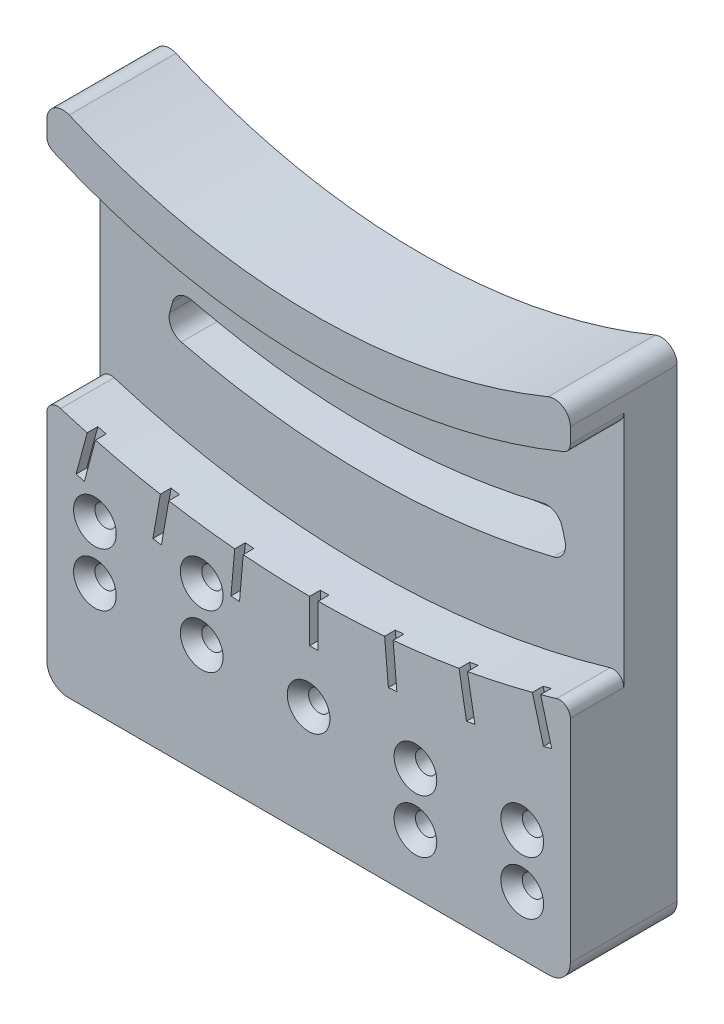
from build123d import *

# Parameters (mm, degrees)
SKETCH1_W           = 49
SKETCH1_H           = 21
SKETCH1_R           = 1
BOSS_EXTRUDE4_DEPTH = 10
CHAMFER2_SIZE       = 1
FILLET2_R           = 2
SKETCH2_W           = 49
SKETCH2_H           = 10
BOSS_EXTRUDE5_DEPTH = 30
CUT_EXTRUDE1_DEPTH  = 73
CUT_EXTRUDE2_DEPTH  = 5
SKETCH4_4_W         = 0.8
SKETCH4_4_H         = 8
CUT_EXTRUDE3_DEPTH  = 1
FILLET4_R           = 1.5
FILLET6_R           = 1.5
FILLET7_R           = 1


with BuildPart() as part:
    # Sketch1 → Boss-Extrude4 (new body)
    with BuildSketch(Plane.XY):
        with Locations((3.999954481, 0.020373254)):
            Rectangle(SKETCH1_W, SKETCH1_H)
        with Locations((-16.000045519, 0.020373254)):
            Circle(SKETCH1_R, mode=Mode.SUBTRACT)
        with Locations((-6.000045519, 0.020373254)):
            Circle(SKETCH1_R, mode=Mode.SUBTRACT)
        with Locations((13.999954481, -4.979626746)):
            Circle(SKETCH1_R, mode=Mode.SUBTRACT)
        with Locations((23.999954481, -4.979626746)):
            Circle(SKETCH1_R, mode=Mode.SUBTRACT)
        with Locations((-16.000045519, 5.020373254)):
            Circle(SKETCH1_R, mode=Mode.SUBTRACT)
        with Locations((3.999954481, 0.020373254)):
            Circle(SKETCH1_R, mode=Mode.SUBTRACT)
        with Locations((-6.000045519, 5.020373254)):
            Circle(SKETCH1_R, mode=Mode.SUBTRACT)
        with Locations((13.999954481, 0.020373254)):
            Circle(SKETCH1_R, mode=Mode.SUBTRACT)
        with Locations((23.999954481, 0.020373254)):
            Circle(SKETCH1_R, mode=Mode.SUBTRACT)
    extrude(amount=BOSS_EXTRUDE4_DEPTH)

    # Chamfer2
    chamfer2_edges = [part.edges().sort_by_distance(p)[0] for p in [
        (-17.000045519, 0.020373254, 10),
        (-17.000045519, 5.020373254, 10),
        (-7.000045519, 5.020373254, 10),
        (-7.000045519, 0.020373254, 10),
        (2.999954481, 0.020373254, 10),
        (22.999954481, 0.020373254, 10),
        (12.999954481, 0.020373254, 10),
        (12.999954481, -4.979626746, 10),
        (22.999954481, -4.979626746, 10),
    ]]
    chamfer(chamfer2_edges, length=CHAMFER2_SIZE)

    # Fillet2
    fillet2_edges = [part.edges().sort_by_distance(p)[0] for p in [
        (-20.500045519, -10.479626746, 5),
        (28.499954481, -10.479626746, 5),
    ]]
    fillet(fillet2_edges, radius=FILLET2_R)

    # Sketch2 → Boss-Extrude5 (add)
    with BuildSketch(Plane(origin=(0, 10.520373254, 0), x_dir=(1, 0, 0), z_dir=(0, 1, 0))):
        with Locations((3.999954481, -5)):
            Rectangle(SKETCH2_W, SKETCH2_H)
    extrude(amount=BOSS_EXTRUDE5_DEPTH)

    # Sketch4 → Cut-Extrude1 (cut)
    with BuildSketch(Plane.XY.offset(10)):
        with BuildLine():
            ThreePointArc((22.358468593, 22.87149124), (4.499954481, 20.520373254), (-13.358559631, 22.87149124))
            Line((-13.358559631, 22.87149124), (-14.393835812, 19.007787935))
            ThreePointArc((-14.393835812, 19.007787935), (4.499954481, 16.520373254), (23.393744773, 19.007787935))
            Line((23.393744773, 19.007787935), (22.358468593, 22.87149124))
        make_face()
        with BuildLine():
            Line((-20.500045519, 40.520373254), (-20.500045519, 37.739585311))
            ThreePointArc((-20.500045519, 37.739585311), (3.947268557, 32.023029505), (28.499954481, 37.268579027))
            Line((28.499954481, 37.268579027), (28.499954481, 40.520373254))
            Line((28.499954481, 40.520373254), (-20.500045519, 40.520373254))
        make_face()
    extrude(amount=-CUT_EXTRUDE1_DEPTH, mode=Mode.SUBTRACT)

    # Sketch4<3> → Cut-Extrude2 (cut)
    with BuildSketch(Plane.XY.offset(10)):
        with BuildLine():
            Line((-20.500045519, 33.33096144), (-20.500045519, 13.000767923))
            ThreePointArc((-20.500045519, 13.000767923), (3.975052557, 9.022084589), (28.499954481, 12.681255612))
            Line((28.499954481, 12.681255612), (28.499954481, 32.89661499))
            ThreePointArc((28.499954481, 32.89661499), (3.95482678, 28.022789271), (-20.500045519, 33.33096144))
        make_face()
        with BuildLine():
            ThreePointArc((-13.358559631, 22.87149124), (4.499954481, 20.520373254), (22.358468593, 22.87149124))
            Line((22.358468593, 22.87149124), (23.393744773, 19.007787935))
            ThreePointArc((23.393744773, 19.007787935), (4.499954481, 16.520373254), (-14.393835812, 19.007787935))
            Line((-14.393835812, 19.007787935), (-13.358559631, 22.87149124))
        make_face(mode=Mode.SUBTRACT)
    extrude(amount=-CUT_EXTRUDE2_DEPTH, mode=Mode.SUBTRACT)

    # Sketch4<4> → Cut-Extrude3 (cut)
    with BuildSketch(Plane.XY.offset(10)):
        Polygon((-1.76898196, 13.276616553), (-2.565937719, 13.346341147), (-3.26318366, 5.376783563), (-2.466227902, 5.307058968), align=None)
        with Locations((4.499954481, 9.020373254)):
            Rectangle(SKETCH4_4_W, SKETCH4_4_H)
        Polygon((-9.178054212, 14.25203942), (-10.567239633, 6.373577396), (-9.779393431, 6.234658854), (-8.390208009, 14.113120878), align=None)
        Polygon((12.263092622, 5.376783563), (11.56584668, 13.346341147), (10.768890922, 13.276616553), (11.466136864, 5.307058968), align=None)
        Polygon((-15.6860728, 15.730575161), (-17.756625161, 8.003168551), (-16.9838845, 7.796113315), (-14.913332139, 15.523519925), align=None)
        Polygon((19.567148595, 6.373577396), (18.177963174, 14.25203942), (17.390116971, 14.113120878), (18.779302393, 6.234658854), align=None)
        Polygon((23.913241101, 15.523519925), (25.983793462, 7.796113315), (26.756534123, 8.003168551), (24.685981762, 15.730575161), align=None)
    extrude(amount=-CUT_EXTRUDE3_DEPTH, mode=Mode.SUBTRACT)

    # Fillet4
    fillet4_edges = [part.edges().sort_by_distance(p)[0] for p in [
        (-14.393835812, 19.007787935, 2.5),
        (-13.358559631, 22.87149124, 2.5),
        (22.358468593, 22.87149124, 2.5),
        (23.393744773, 19.007787935, 2.5),
    ]]
    fillet(fillet4_edges, radius=FILLET4_R)

    # Fillet6
    fillet6_edges = [part.edges().sort_by_distance(p)[0] for p in [
        (-20.500045519, 37.739585311, 5),
        (28.499954481, 37.268579027, 5),
    ]]
    fillet(fillet6_edges, radius=FILLET6_R)

    # Fillet7
    fillet7_edges = [part.edges().sort_by_distance(p)[0] for p in [
        (28.499954481, 12.681255612, 7.5),
        (-20.500045519, 13.000767923, 7.5),
        (-20.500045519, 33.33096144, 7.5),
        (28.499954481, 32.89661499, 7.5),
    ]]
    fillet(fillet7_edges, radius=FILLET7_R)


solid = part.part
